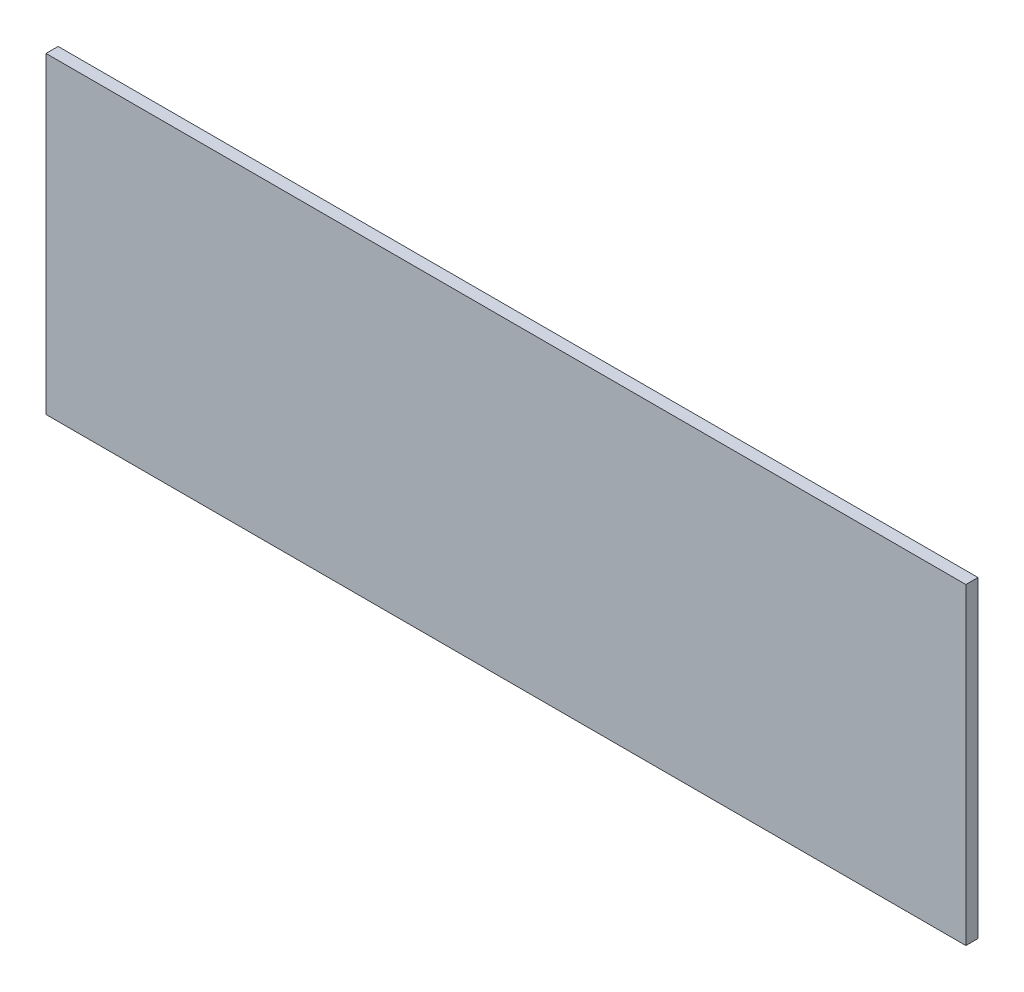
from build123d import *

# Parameters (mm, degrees)
ESQUISSE1_W        = 303
ESQUISSE1_H        = 103
BOSS_EXTRU_1_DEPTH = 4


with BuildPart() as part:
    # Esquisse1 → Boss.-Extru.1 (new body)
    with BuildSketch(Plane.XY):
        Rectangle(ESQUISSE1_W, ESQUISSE1_H)
    extrude(amount=BOSS_EXTRU_1_DEPTH)


solid = part.part
